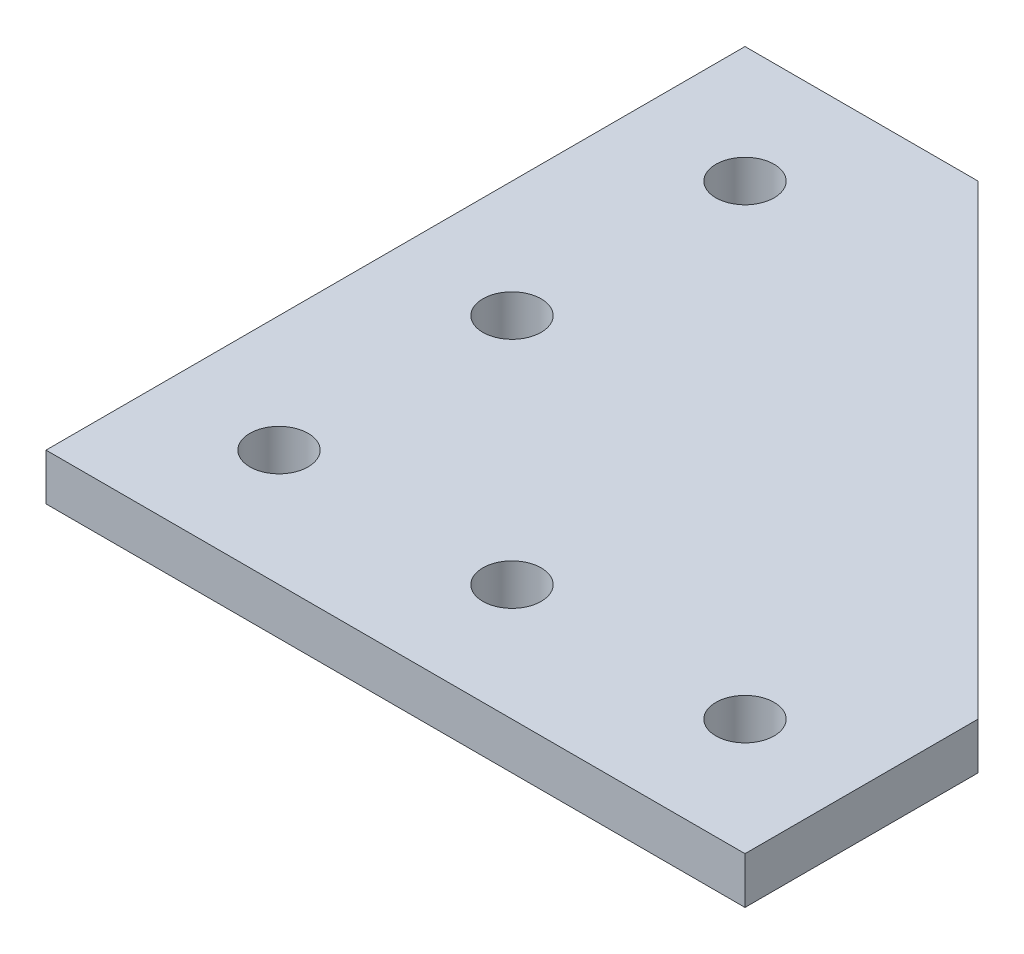
from build123d import *

# Parameters (mm, degrees)
BOSS_EXTRUDE1_DEPTH     = 2
CUT_EXTRUDE1_DEPTH      = 71.738956735
CUT_EXTRUDE1_DEPTH_BACK = 71.738956735
SKETCH3_R               = 2.5


with BuildPart() as part:
    # Sketch1 → Boss-Extrude1 (new, symmetric)
    with BuildSketch(Plane(origin=(0, 0, 0), x_dir=(1, 0, 0), z_dir=(0, 1, 0))):
        Polygon((-10, -10), (-10, 50), (10, 50), (50, 10), (50, -10), align=None)
    extrude(amount=BOSS_EXTRUDE1_DEPTH, both=True)

    # Sketch3 → Cut-Extrude1 (cut, two sides: drawn at the far end of the back side and taken through both)
    with BuildSketch(Plane(origin=(0, 0, 0), x_dir=(1, 0, 0), z_dir=(0, 1, 0)).offset(-CUT_EXTRUDE1_DEPTH_BACK)):
        with Locations(Location((0, 0, 0), (0, 0, 270))):
            Circle(SKETCH3_R)
        with Locations(Location((20, 0, 0), (0, 0, 270))):
            Circle(SKETCH3_R)
        with Locations(Location((40, 0, 0), (0, 0, 270))):
            Circle(SKETCH3_R)
        with Locations(Location((0, 20, 0), (0, 0, 270))):
            Circle(SKETCH3_R)
        with Locations(Location((0, 40, 0), (0, 0, 270))):
            Circle(SKETCH3_R)
    extrude(amount=CUT_EXTRUDE1_DEPTH + CUT_EXTRUDE1_DEPTH_BACK, mode=Mode.SUBTRACT)


solid = part.part
